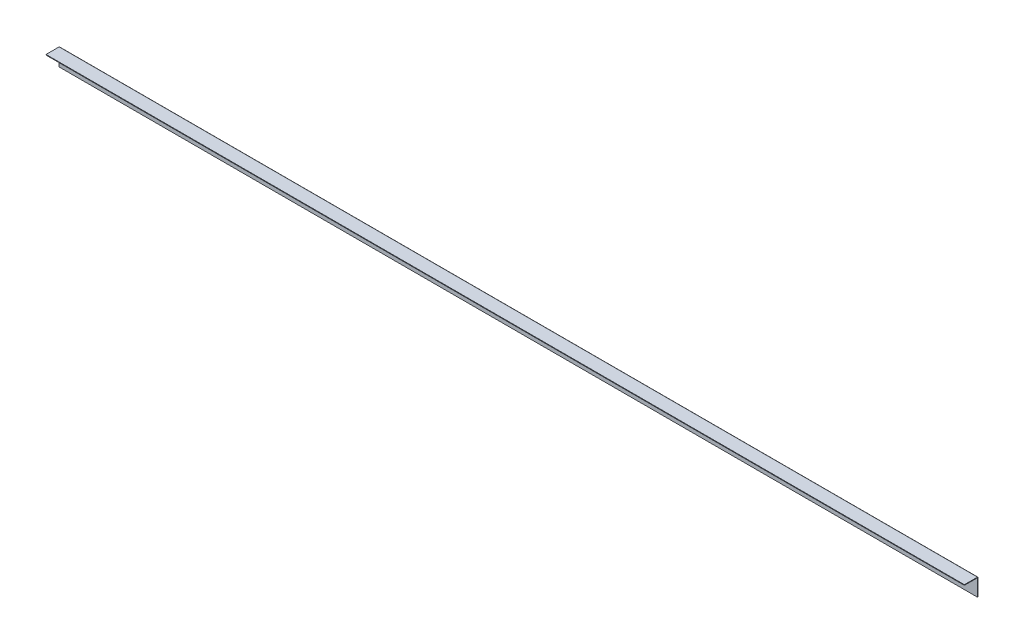
from build123d import *

# Parameters (mm, degrees)
BOSS_EXTRUDE1_DEPTH = 4922
FILLET1_R           = 3


with BuildPart() as part:
    # Sketch1 → Boss-Extrude1 (new body)
    with BuildSketch(Plane(origin=(0, 0, 0), x_dir=(0, 0, -1), z_dir=(1, 0, 0))):
        Polygon((0, 0), (73, 0), (73, -93), (70, -93), (70, -3), (0, -3), align=None)
    extrude(amount=BOSS_EXTRUDE1_DEPTH)

    # Fillet1
    fillet1_edges = [part.edges().sort_by_distance(p)[0] for p in [
        (2461, 0, -73),
        (2461, -3, -70),
    ]]
    fillet(fillet1_edges, radius=FILLET1_R)


solid = part.part
